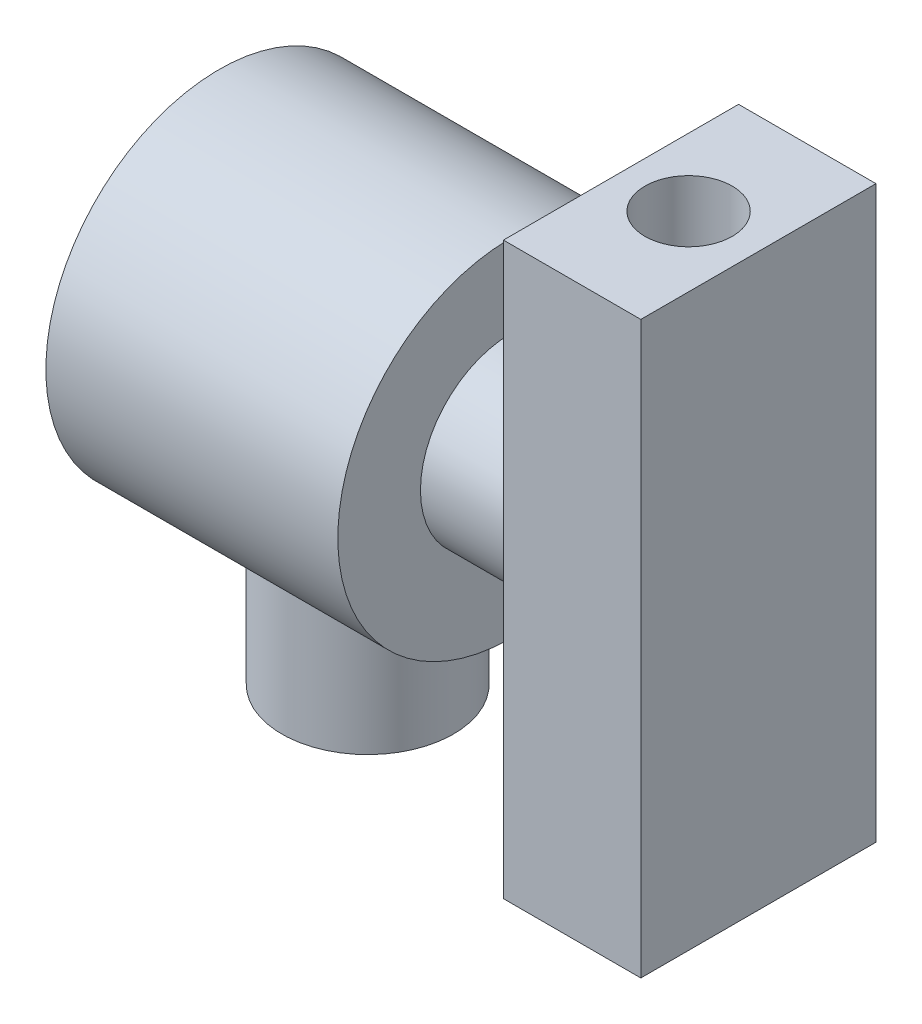
from build123d import *

# Parameters (mm, degrees)
SKETCH2_R           = 25.225
BOSS_EXTRUDE1_DEPTH = 42.5
SKETCH3_R           = 13.197131212
BOSS_EXTRUDE2_DEPTH = 16
SKETCH4_W           = 34.230022124
SKETCH4_H           = 83.030932044
BOSS_EXTRUDE3_DEPTH = 20
SKETCH6_R           = 6.35
CUT_EXTRUDE1_DEPTH  = 20
SKETCH7_R           = 6.35
CUT_EXTRUDE2_DEPTH  = 20
SKETCH8_R           = 12.5
BOSS_EXTRUDE4_DEPTH = 19


with BuildPart() as part:
    # Sketch2 → Boss-Extrude1 (new body)
    with BuildSketch(Plane(origin=(0, 0, 0), x_dir=(0, 0, -1), z_dir=(1, 0, 0))):
        Circle(SKETCH2_R)
    extrude(amount=BOSS_EXTRUDE1_DEPTH)

    # Sketch8 → Boss-Extrude4 (add)
    with BuildSketch(Plane.XZ.offset(41.515466022)):
        with Locations(Location((21.61998888, 0, 0), (0, 0, 270))):
            Circle(SKETCH8_R)
    extrude(amount=-BOSS_EXTRUDE4_DEPTH)


with BuildPart() as body_2:
    # Sketch3 → Boss-Extrude2 (new body)
    with BuildSketch(Plane(origin=(42.5, 0, 0), x_dir=(0, 0, -1), z_dir=(1, 0, 0))):
        Circle(SKETCH3_R)
    extrude(amount=BOSS_EXTRUDE2_DEPTH)


with BuildPart() as body_3:
    # Sketch4 → Boss-Extrude3 (new body)
    with BuildSketch(Plane(origin=(58.5, 0, 0), x_dir=(0, 0, -1), z_dir=(1, 0, 0))):
        Rectangle(SKETCH4_W, SKETCH4_H)
    extrude(amount=BOSS_EXTRUDE3_DEPTH)

    # Sketch6 → Cut-Extrude1 (cut)
    with BuildSketch(Plane(origin=(0, 41.515466022, 0), x_dir=(1, 0, 0), z_dir=(0, 1, 0))):
        with Locations(Location((68.339291029, 0, 0), (0, 0, 270))):
            Circle(SKETCH6_R)
    extrude(amount=-CUT_EXTRUDE1_DEPTH, mode=Mode.SUBTRACT)

    # Sketch7 → Cut-Extrude2 (cut)
    with BuildSketch(Plane.XZ.offset(41.515466022)):
        with Locations(Location((68.475312175, 0, 0), (0, 0, 270))):
            Circle(SKETCH7_R)
    extrude(amount=-CUT_EXTRUDE2_DEPTH, mode=Mode.SUBTRACT)


solid = Compound([part.part, body_2.part, body_3.part])
